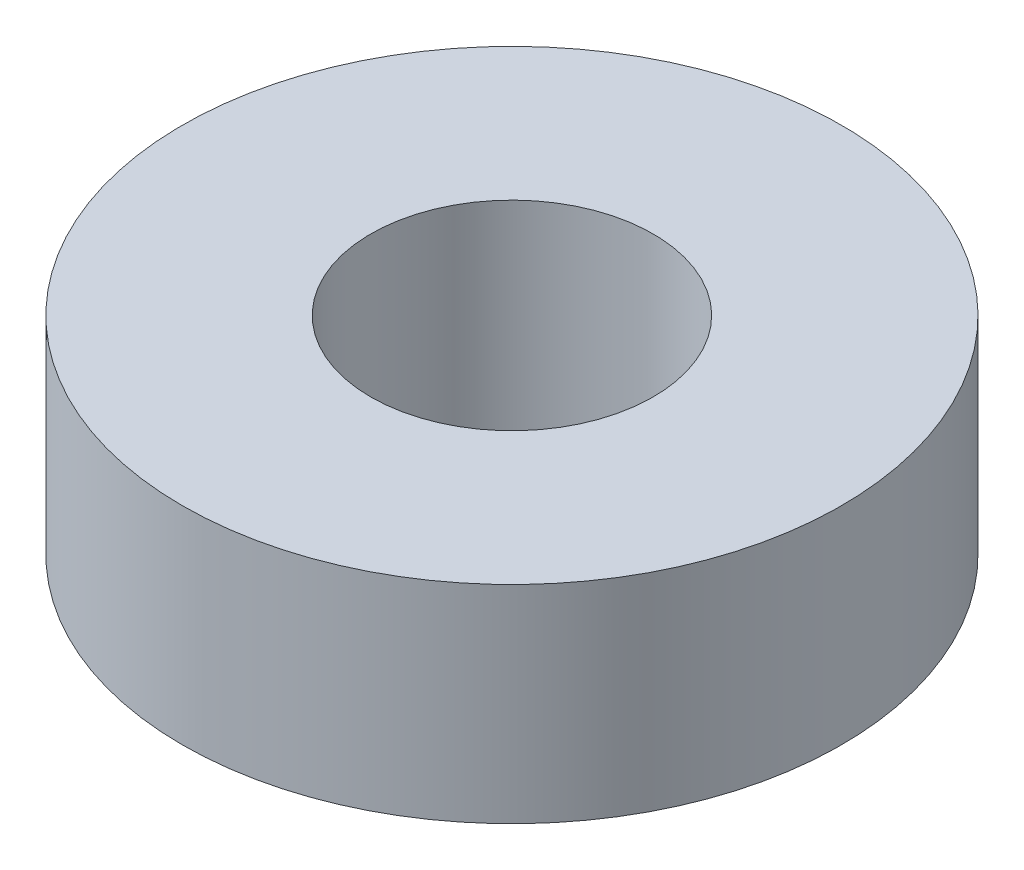
from build123d import *

# Parameters (mm, degrees)
SKETCH3_R           = 17.5
SKETCH3_R_2         = 7.5
BOSS_EXTRUDE1_DEPTH = 11


with BuildPart() as part:
    # Sketch3 → Boss-Extrude1 (new body)
    with BuildSketch(Plane(origin=(0, 0, 0), x_dir=(1, 0, 0), z_dir=(0, 1, 0))):
        Circle(SKETCH3_R)
        Circle(SKETCH3_R_2, mode=Mode.SUBTRACT)
    extrude(amount=BOSS_EXTRUDE1_DEPTH)


solid = part.part
